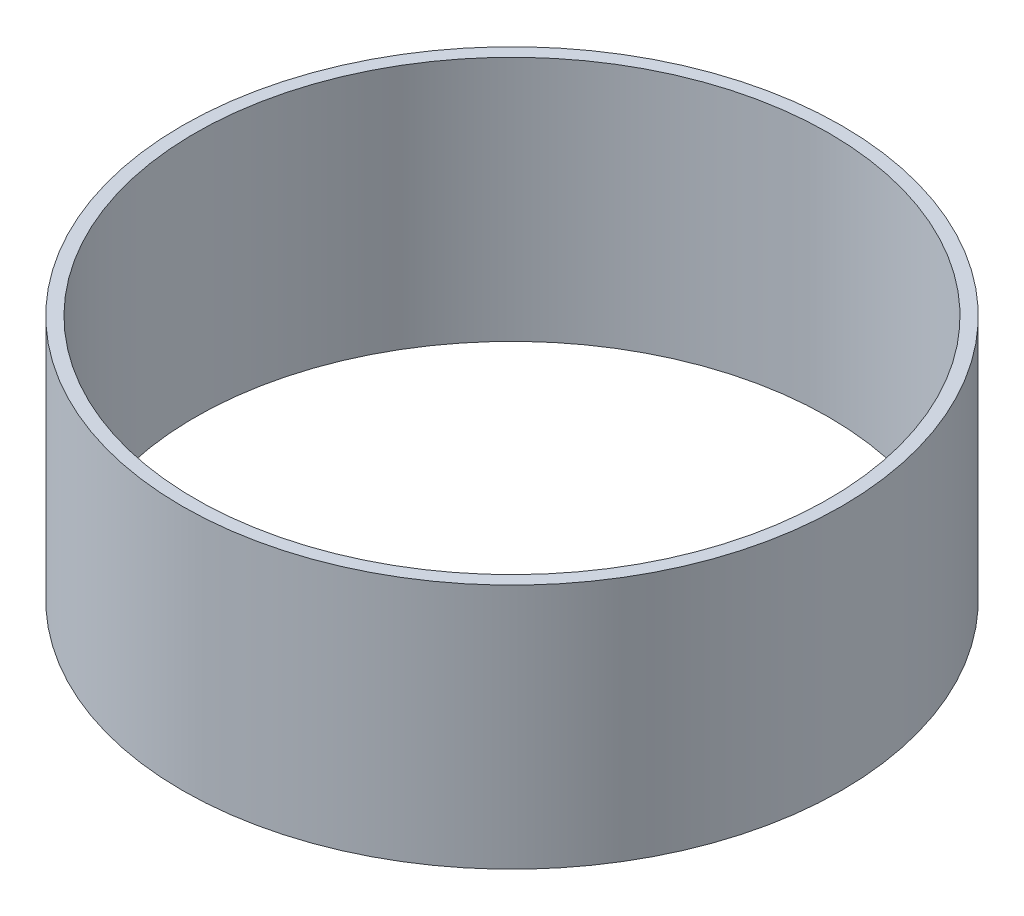
from build123d import *

# Parameters (mm, degrees)
SKETCH2_R           = 51.054
SKETCH2_R_2         = 49.0601
BOSS_EXTRUDE1_DEPTH = 38.1


with BuildPart() as part:
    # Sketch2 → Boss-Extrude1 (new body)
    with BuildSketch(Plane(origin=(0, 0, 0), x_dir=(1, 0, 0), z_dir=(0, 1, 0))):
        with Locations(Location((0, 0, 0), (0, 0, 90))):
            Circle(SKETCH2_R)
        with Locations(Location((0, 0, 0), (0, 0, 90))):
            Circle(SKETCH2_R_2, mode=Mode.SUBTRACT)
    extrude(amount=BOSS_EXTRUDE1_DEPTH)


solid = part.part
